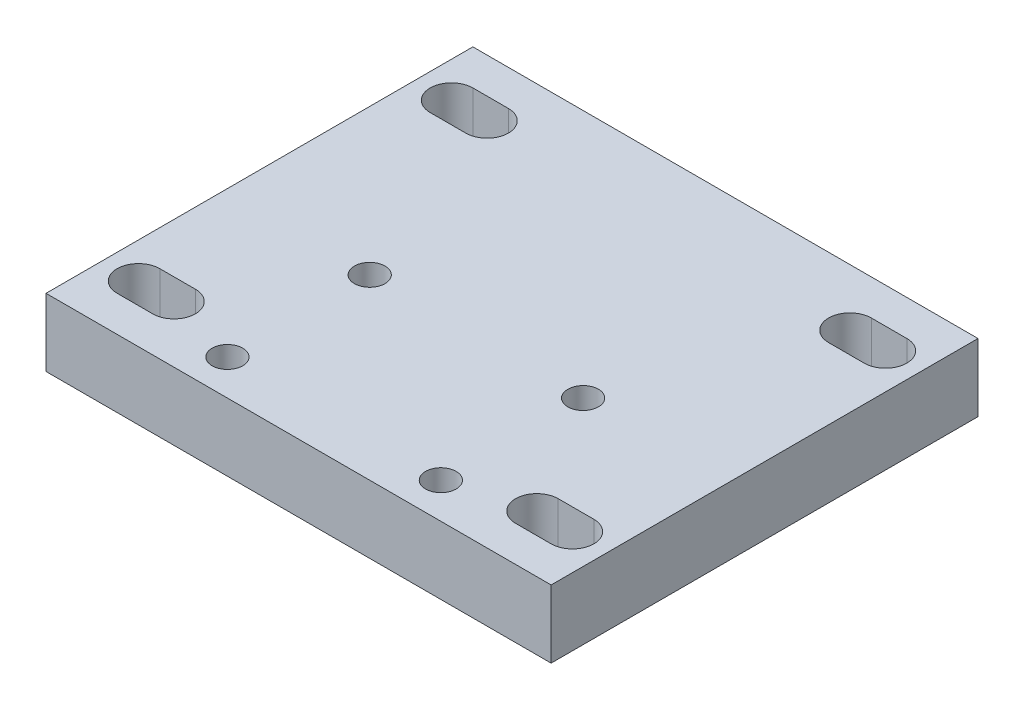
from build123d import *

# Parameters (mm, degrees)
CROQUIS2_W                                           = 71
CROQUIS2_H                                           = 9.52
SALIENTE_EXTRUIR1_DEPTH                              = 60
CROQUIS3_R                                           = 2.38
CORTAR_EXTRUIR1_DEPTH                                = 15
CORTAR_EXTRUIR2_REACH                                = 95.443
REFRENTADO_PARA_TORNILLO_TAP_N_CON_CABEZ_D           = 4.3
REFRENTADO_PARA_TORNILLO_TAP_N_CON_CABEZ_DEPTH       = 17
REFRENTADO_PARA_TORNILLO_TAP_N_CON_CABEZ_CBORE_D     = 7.5
REFRENTADO_PARA_TORNILLO_TAP_N_CON_CABEZ_CBORE_DEPTH = 4
REFRENTADO_PARA_TORNILLO_TAP_N_CON_CABEZ_TIP         = 1.291850331


with BuildPart() as part:
    # Croquis2 → Saliente-Extruir1 (new body)
    with BuildSketch(Plane.XY):
        with Locations((35.5, 4.76)):
            Rectangle(CROQUIS2_W, CROQUIS2_H)
    extrude(amount=SALIENTE_EXTRUIR1_DEPTH)

    # Croquis3 → Cortar-Extruir1 (cut)
    with BuildSketch(Plane(origin=(0, 0, 0), x_dir=(-1, 0, 0), z_dir=(0, 0, -1))):
        with Locations((-54, 4.74)):
            Circle(CROQUIS3_R)
        with Locations((-18, 4.74)):
            Circle(CROQUIS3_R)
    extrude(amount=-CORTAR_EXTRUIR1_DEPTH, mode=Mode.SUBTRACT)

    # Croquis4 → Cortar-Extruir2 (cut, up to next)
    with BuildSketch(Plane(origin=(0, 9.52, 0), x_dir=(1, 0, 0), z_dir=(0, 1, 0)), mode=Mode.PRIVATE) as cortar_extruir2_sk1:
        with BuildLine():
            Line((61, -5), (66, -5))
            ThreePointArc((66, -5), (69, -8), (66, -11))
            Line((66, -11), (61, -11))
            ThreePointArc((61, -11), (58, -8), (61, -5))
        make_face()
    cortar_extruir2_tool1 = extrude(cortar_extruir2_sk1.sketch, amount=-CORTAR_EXTRUIR2_REACH, mode=Mode.PRIVATE) & part.part
    # Croquis4 → Cortar-Extruir2 (cut, up to next)
    with BuildSketch(Plane(origin=(0, 9.52, 0), x_dir=(1, 0, 0), z_dir=(0, 1, 0)), mode=Mode.PRIVATE) as cortar_extruir2_sk2:
        with BuildLine():
            Line((61, -49), (66, -49))
            ThreePointArc((66, -49), (69, -52), (66, -55))
            Line((66, -55), (61, -55))
            ThreePointArc((61, -55), (58, -52), (61, -49))
        make_face()
    cortar_extruir2_tool2 = extrude(cortar_extruir2_sk2.sketch, amount=-CORTAR_EXTRUIR2_REACH, mode=Mode.PRIVATE) & part.part
    # Croquis4 → Cortar-Extruir2 (cut, up to next)
    with BuildSketch(Plane(origin=(0, 9.52, 0), x_dir=(1, 0, 0), z_dir=(0, 1, 0)), mode=Mode.PRIVATE) as cortar_extruir2_sk3:
        with BuildLine():
            Line((5, -5), (10, -5))
            ThreePointArc((10, -5), (13, -8), (10, -11))
            Line((10, -11), (5, -11))
            ThreePointArc((5, -11), (2, -8), (5, -5))
        make_face()
    cortar_extruir2_tool3 = extrude(cortar_extruir2_sk3.sketch, amount=-CORTAR_EXTRUIR2_REACH, mode=Mode.PRIVATE) & part.part
    # Croquis4 → Cortar-Extruir2 (cut, up to next)
    with BuildSketch(Plane(origin=(0, 9.52, 0), x_dir=(1, 0, 0), z_dir=(0, 1, 0)), mode=Mode.PRIVATE) as cortar_extruir2_sk4:
        with BuildLine():
            Line((5, -49), (10, -49))
            ThreePointArc((10, -49), (13, -52), (10, -55))
            Line((10, -55), (5, -55))
            ThreePointArc((5, -55), (2, -52), (5, -49))
        make_face()
    cortar_extruir2_tool4 = extrude(cortar_extruir2_sk4.sketch, amount=-CORTAR_EXTRUIR2_REACH, mode=Mode.PRIVATE) & part.part
    add(cortar_extruir2_tool1.solids().sort_by_distance((63.5, 9.52, 8))[0], mode=Mode.SUBTRACT)
    add(cortar_extruir2_tool2.solids().sort_by_distance((63.5, 9.52, 52))[0], mode=Mode.SUBTRACT)
    add(cortar_extruir2_tool3.solids().sort_by_distance((7.5, 9.52, 8))[0], mode=Mode.SUBTRACT)
    add(cortar_extruir2_tool4.solids().sort_by_distance((7.5, 9.52, 52))[0], mode=Mode.SUBTRACT)

    # Refrentado para tornillo tapón con cabeza de clavija de M41
    with Locations(Plane(origin=(0, 0, 0), x_dir=(-1, 0, 0), z_dir=(0, -1, 0))):
        with Locations((-50.5, -35), (-50.5, -55), (-20.5, -55), (-20.5, -35)):
            CounterBoreHole(REFRENTADO_PARA_TORNILLO_TAP_N_CON_CABEZ_D / 2, REFRENTADO_PARA_TORNILLO_TAP_N_CON_CABEZ_CBORE_D / 2, REFRENTADO_PARA_TORNILLO_TAP_N_CON_CABEZ_CBORE_DEPTH, depth=REFRENTADO_PARA_TORNILLO_TAP_N_CON_CABEZ_DEPTH)
            with Locations((0, 0, -(REFRENTADO_PARA_TORNILLO_TAP_N_CON_CABEZ_DEPTH + REFRENTADO_PARA_TORNILLO_TAP_N_CON_CABEZ_TIP / 2))):  # 118° drill point
                Cone(0, REFRENTADO_PARA_TORNILLO_TAP_N_CON_CABEZ_D / 2, REFRENTADO_PARA_TORNILLO_TAP_N_CON_CABEZ_TIP, mode=Mode.SUBTRACT)


solid = part.part
